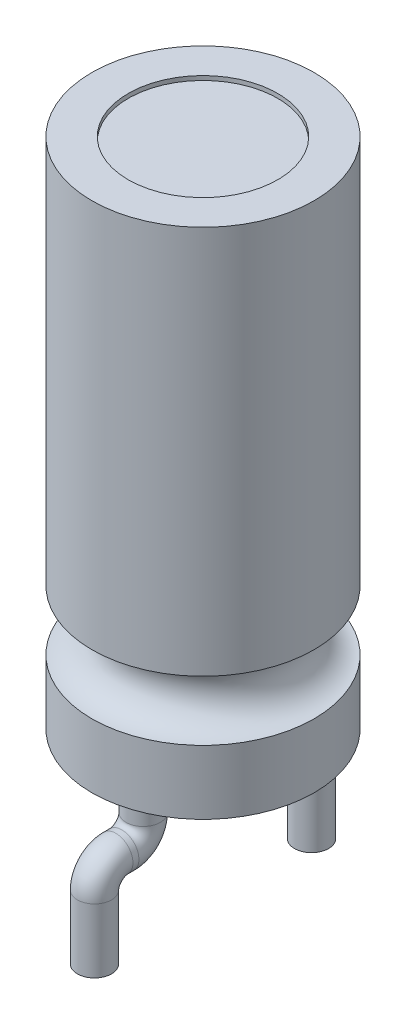
from build123d import *

# Parameters (mm, degrees)
ESQUISSE2_R             = 1.75
ENL_V_MAT_EXTRU_1_DEPTH = 0.1
ESQUISSE3_R             = 0.4
ESQUISSE6_R             = 0.4


with BuildPart() as part:
    # Esquisse1 → Révolution1 (revolve)
    with BuildSketch(Plane.XY, mode=Mode.PRIVATE) as r_volution1_sk:
        with BuildLine():
            Line((0, 39.516423663), (2.6, 39.516423663))
            Line((2.6, 39.516423663), (2.6, 30.416423663))
            ThreePointArc((2.6, 30.416423663), (1.9, 29.716423663), (2.6, 29.016423663))
            Line((2.6, 29.016423663), (2.6, 27.516423663))
            Line((2.6, 27.516423663), (0, 27.516423663))
            Line((0, 27.516423663), (0, 39.516423663))
        make_face()
    revolve(r_volution1_sk.sketch.rotate(Axis((0, 48.401709402, 0), (0, -1, 0)), 90), axis=Axis((0, 48.401709402, 0), (0, -1, 0)))

    # Esquisse2 → Enlèv. mat.-Extru.1 (cut)
    with BuildSketch(Plane(origin=(0, 39.516423663, 0), x_dir=(-1, 0, 0), z_dir=(0, 1, 0))):
        with Locations(Location((0, 0, 0), (0, 0, 90))):
            Circle(ESQUISSE2_R)
    extrude(amount=-ENL_V_MAT_EXTRU_1_DEPTH, mode=Mode.SUBTRACT)

    # Balayage2: sweep along a path in Esquisse4
    with BuildLine(Plane(origin=(0, 0, 0), x_dir=(0, 0, -1), z_dir=(1, 0, 0))) as balayage2_path:
        Line((-1.4, 27.516423663), (-1.4, 26.516423663))
        ThreePointArc((-1.4, 26.516423663), (-1.546446609, 26.162870273), (-1.9, 26.016423663))
        Line((-1.9, 26.016423663), (-2.04, 26.016423663))
        ThreePointArc((-2.04, 26.016423663), (-2.393553391, 25.869977054), (-2.54, 25.516423663))
        Line((-2.54, 25.516423663), (-2.54, 24.016423663))
    # Esquisse3 → Balayage2 (sweep)
    with BuildSketch(Plane.XZ.offset(-27.516423663)):
        with Locations((0, 1.4)):
            Circle(ESQUISSE3_R)
    sweep(path=balayage2_path.line)

    # Balayage3: sweep along a path in Esquisse7
    with BuildLine(Plane(origin=(0, 0, 0), x_dir=(0, 0, -1), z_dir=(1, 0, 0))) as balayage3_path:
        Line((1.4, 27.516423663), (1.4, 26.516423663))
        ThreePointArc((1.4, 26.516423663), (1.546446609, 26.162870273), (1.9, 26.016423663))
        Line((1.9, 26.016423663), (2.04, 26.016423663))
        ThreePointArc((2.04, 26.016423663), (2.393553391, 25.869977054), (2.54, 25.516423663))
        Line((2.54, 25.516423663), (2.54, 24.016423663))
    # Esquisse6 → Balayage3 (sweep)
    with BuildSketch(Plane.XZ.offset(-27.516423663)):
        with Locations((0, -1.4)):
            Circle(ESQUISSE6_R)
    sweep(path=balayage3_path.line)


solid = part.part
